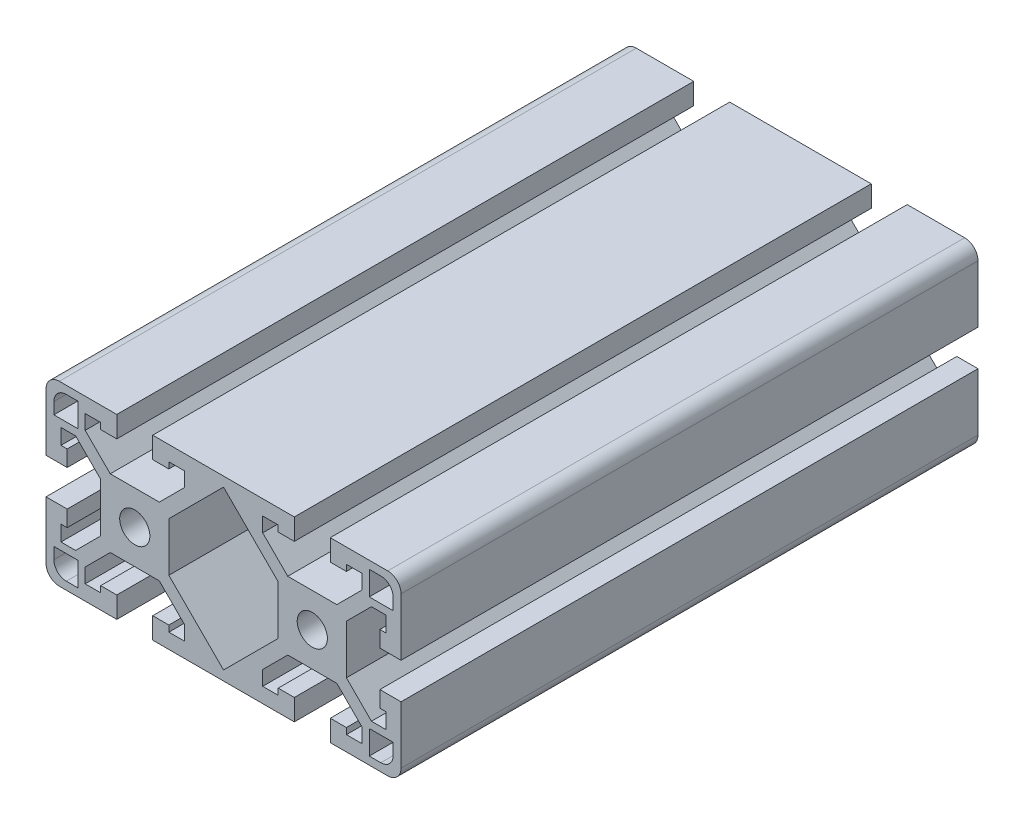
from build123d import *

# Parameters (mm, degrees)
SKETCH2_R                            = 3.35
F_40_SERIES_TS40_80LM_650037_1_DEPTH = 130
M8X1_25_TAPPED_HOLE1_D               = 6.8
M8X1_25_TAPPED_HOLE1_DEPTH           = 30
M8X1_25_TAPPED_HOLE1_TIP             = 2.042926105


with BuildPart() as part:
    # Sketch2 → 40 series TS40-80LM-650037(1) (new body)
    with BuildSketch(Plane(origin=(0, 0, -130), x_dir=(0, 1, 0), z_dir=(0, 0, 1))):
        with BuildLine():
            Line((0, -27.681), (-5.525738531, -27.681))
            Line((-5.525738531, -27.681), (-11.176, -33.331261469))
            Line((-11.176, -33.331261469), (-11.176, -36.6218))
            Line((-11.176, -36.6218), (-7.6835, -36.6218))
            Line((-7.6835, -36.6218), (-7.6835, -35.2248))
            Line((-7.6835, -35.2248), (-4.0488, -35.2248))
            Line((-4.0488, -35.2248), (-4.0488, -40))
            Line((-4.0488, -40), (-17, -40))
            ThreePointArc((-17, -40), (-19.121320344, -39.121320344), (-20, -37))
            Line((-20, -37), (-20, -24.0488))
            Line((-20, -24.0488), (-15.2248, -24.0488))
            Line((-15.2248, -24.0488), (-15.2248, -27.6835))
            Line((-15.2248, -27.6835), (-16.6218, -27.6835))
            Line((-16.6218, -27.6835), (-16.6218, -31.176))
            Line((-16.6218, -31.176), (-13.331261469, -31.176))
            Line((-13.331261469, -31.176), (-7.681, -25.525738531))
            Line((-7.681, -25.525738531), (-7.681, -20))
            Line((-7.681, -20), (-7.681, -14.474261469))
            Line((-7.681, -14.474261469), (-13.331261469, -8.824))
            Line((-13.331261469, -8.824), (-16.6218, -8.824))
            Line((-16.6218, -8.824), (-16.6218, -12.3165))
            Line((-16.6218, -12.3165), (-15.2248, -12.3165))
            Line((-15.2248, -12.3165), (-15.2248, -15.9512))
            Line((-15.2248, -15.9512), (-20, -15.9512))
            Line((-20, -15.9512), (-20, 15.9512))
            Line((-20, 15.9512), (-15.2248, 15.9512))
            Line((-15.2248, 15.9512), (-15.2248, 12.3165))
            Line((-15.2248, 12.3165), (-16.6218, 12.3165))
            Line((-16.6218, 12.3165), (-16.6218, 8.824))
            Line((-16.6218, 8.824), (-13.331261469, 8.824))
            Line((-13.331261469, 8.824), (-7.681, 14.474261469))
            Line((-7.681, 14.474261469), (-7.681, 25.525738531))
            Line((-7.681, 25.525738531), (-13.331261469, 31.176))
            Line((-13.331261469, 31.176), (-16.6218, 31.176))
            Line((-16.6218, 31.176), (-16.6218, 27.6835))
            Line((-16.6218, 27.6835), (-15.2248, 27.6835))
            Line((-15.2248, 27.6835), (-15.2248, 24.0488))
            Line((-15.2248, 24.0488), (-20, 24.0488))
            Line((-20, 24.0488), (-20, 37))
            ThreePointArc((-20, 37), (-19.121320344, 39.121320344), (-17, 40))
            Line((-17, 40), (-4.0488, 40))
            Line((-4.0488, 40), (-4.0488, 35.2248))
            Line((-4.0488, 35.2248), (-7.6835, 35.2248))
            Line((-7.6835, 35.2248), (-7.6835, 36.6218))
            Line((-7.6835, 36.6218), (-11.176, 36.6218))
            Line((-11.176, 36.6218), (-11.176, 33.331261469))
            Line((-11.176, 33.331261469), (-5.525738531, 27.681))
            Line((-5.525738531, 27.681), (0, 27.681))
            Line((0, 27.681), (5.525738531, 27.681))
            Line((5.525738531, 27.681), (11.176, 33.331261469))
            Line((11.176, 33.331261469), (11.176, 36.6218))
            Line((11.176, 36.6218), (7.6835, 36.6218))
            Line((7.6835, 36.6218), (7.6835, 35.2248))
            Line((7.6835, 35.2248), (4.0488, 35.2248))
            Line((4.0488, 35.2248), (4.0488, 40))
            Line((4.0488, 40), (17, 40))
            ThreePointArc((17, 40), (19.121320344, 39.121320344), (20, 37))
            Line((20, 37), (20, 24.0488))
            Line((20, 24.0488), (15.2248, 24.0488))
            Line((15.2248, 24.0488), (15.2248, 27.6835))
            Line((15.2248, 27.6835), (16.6218, 27.6835))
            Line((16.6218, 27.6835), (16.6218, 31.176))
            Line((16.6218, 31.176), (13.331261469, 31.176))
            Line((13.331261469, 31.176), (7.681, 25.525738531))
            Line((7.681, 25.525738531), (7.681, 20))
            Line((7.681, 20), (7.681, 14.474261469))
            Line((7.681, 14.474261469), (13.331261469, 8.824))
            Line((13.331261469, 8.824), (16.6218, 8.824))
            Line((16.6218, 8.824), (16.6218, 12.3165))
            Line((16.6218, 12.3165), (15.2248, 12.3165))
            Line((15.2248, 12.3165), (15.2248, 15.9512))
            Line((15.2248, 15.9512), (20, 15.9512))
            Line((20, 15.9512), (20, -15.9512))
            Line((20, -15.9512), (15.2248, -15.9512))
            Line((15.2248, -15.9512), (15.2248, -12.3165))
            Line((15.2248, -12.3165), (16.6218, -12.3165))
            Line((16.6218, -12.3165), (16.6218, -8.824))
            Line((16.6218, -8.824), (13.331261469, -8.824))
            Line((13.331261469, -8.824), (7.681, -14.474261469))
            Line((7.681, -14.474261469), (7.681, -20))
            Line((7.681, -20), (7.681, -25.525738531))
            Line((7.681, -25.525738531), (13.331261469, -31.176))
            Line((13.331261469, -31.176), (16.6218, -31.176))
            Line((16.6218, -31.176), (16.6218, -27.6835))
            Line((16.6218, -27.6835), (15.2248, -27.6835))
            Line((15.2248, -27.6835), (15.2248, -24.0488))
            Line((15.2248, -24.0488), (20, -24.0488))
            Line((20, -24.0488), (20, -37))
            ThreePointArc((20, -37), (19.121320344, -39.121320344), (17, -40))
            Line((17, -40), (4.0488, -40))
            Line((4.0488, -40), (4.0488, -35.2248))
            Line((4.0488, -35.2248), (7.6835, -35.2248))
            Line((7.6835, -35.2248), (7.6835, -36.6218))
            Line((7.6835, -36.6218), (11.176, -36.6218))
            Line((11.176, -36.6218), (11.176, -33.331261469))
            Line((11.176, -33.331261469), (5.525738531, -27.681))
            Line((5.525738531, -27.681), (0, -27.681))
        make_face()
        with Locations((0, -20)):
            Circle(SKETCH2_R, mode=Mode.SUBTRACT)
        with Locations((0, 20)):
            Circle(SKETCH2_R, mode=Mode.SUBTRACT)
        Polygon((-5.525738531, 12.319), (-17.844738531, 0), (-5.525738531, -12.319), (0, -12.319), (5.525738531, -12.319), (17.844738531, 0), (5.525738531, 12.319), (0, 12.319), align=None, mode=Mode.SUBTRACT)
        with BuildLine():
            Line((12.8372, 38.222), (12.8372, 32.8372))
            Line((12.8372, 32.8372), (18.222, 32.8372))
            Line((18.222, 32.8372), (18.222, 35.428))
            ThreePointArc((18.222, 35.428), (17.403656347, 37.403656347), (15.428, 38.222))
            Line((15.428, 38.222), (12.8372, 38.222))
        make_face(mode=Mode.SUBTRACT)
        with BuildLine():
            Line((12.8372, -32.8372), (18.222, -32.8372))
            Line((18.222, -32.8372), (18.222, -35.428))
            ThreePointArc((18.222, -35.428), (17.403656347, -37.403656347), (15.428, -38.222))
            Line((15.428, -38.222), (12.8372, -38.222))
            Line((12.8372, -38.222), (12.8372, -32.8372))
        make_face(mode=Mode.SUBTRACT)
        with BuildLine():
            Line((-12.8372, -38.222), (-12.8372, -32.8372))
            Line((-12.8372, -32.8372), (-18.222, -32.8372))
            Line((-18.222, -32.8372), (-18.222, -35.428))
            ThreePointArc((-18.222, -35.428), (-17.403656347, -37.403656347), (-15.428, -38.222))
            Line((-15.428, -38.222), (-12.8372, -38.222))
        make_face(mode=Mode.SUBTRACT)
        with BuildLine():
            Line((-18.222, 35.428), (-18.222, 32.8372))
            Line((-18.222, 32.8372), (-12.8372, 32.8372))
            Line((-12.8372, 32.8372), (-12.8372, 38.222))
            Line((-12.8372, 38.222), (-15.428, 38.222))
            ThreePointArc((-15.428, 38.222), (-17.403656347, 37.403656347), (-18.222, 35.428))
        make_face(mode=Mode.SUBTRACT)
    extrude(amount=F_40_SERIES_TS40_80LM_650037_1_DEPTH)

    # M8x1.25 Tapped Hole1
    with Locations(Plane.XY):
        with Locations((-20, 0), (20, 0)):
            Hole(M8X1_25_TAPPED_HOLE1_D / 2, depth=M8X1_25_TAPPED_HOLE1_DEPTH)
            with Locations((0, 0, -(M8X1_25_TAPPED_HOLE1_DEPTH + M8X1_25_TAPPED_HOLE1_TIP / 2))):  # 118° drill point
                Cone(0, M8X1_25_TAPPED_HOLE1_D / 2, M8X1_25_TAPPED_HOLE1_TIP, mode=Mode.SUBTRACT)


solid = part.part
